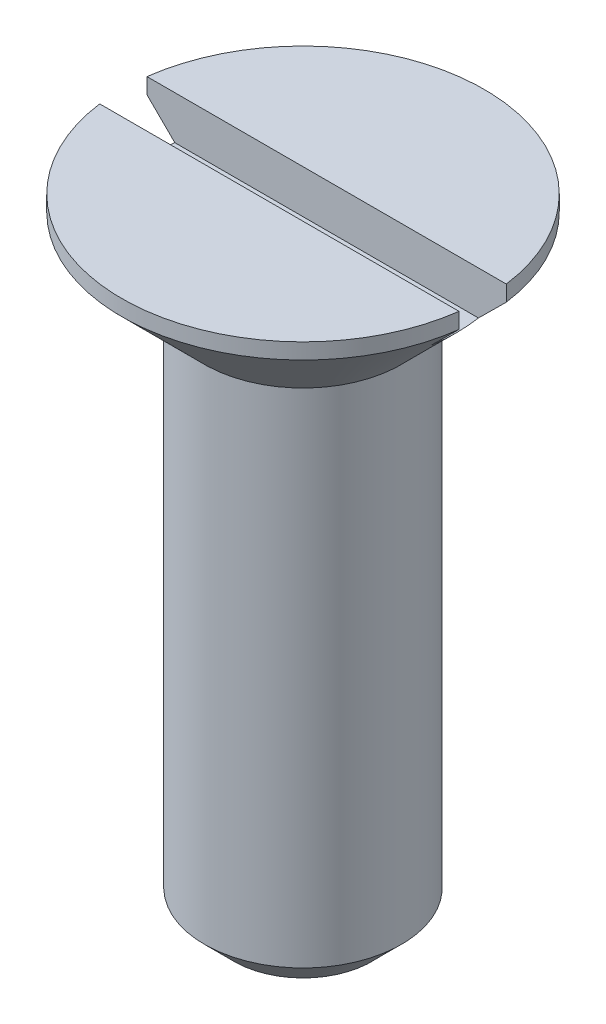
from build123d import *

# Parameters (mm, degrees)
SKETCH_13_W         = 9.2
SKETCH_13_H         = 1.2
CUT_EXTRUDE_9_DEPTH = 1.1
CHAMFER_1_SIZE      = 0.75


with BuildPart() as part:
    # Эскиз1 → Повернуть1 (revolve)
    with BuildSketch(Plane.XY):
        Polygon((0, 16), (0, 0), (2.5, 0), (2.5, 13.5), (4.6, 15.6), (4.6, 16), align=None)
    revolve(axis=Axis((0, 125.763182898, 0), (0, -1, 0)))

    # Эскиз13 → Вырез-Вытянуть9 (cut)
    with BuildSketch(Plane(origin=(0, 16, 0), x_dir=(-1, 0, 0), z_dir=(0, 1, 0))):
        Rectangle(SKETCH_13_W, SKETCH_13_H)
    extrude(amount=-CUT_EXTRUDE_9_DEPTH, mode=Mode.SUBTRACT)

    # Фаска1
    chamfer_1_edges = [part.edges().sort_by_distance(p)[0] for p in [
        (-2.5, 0, 0),
    ]]
    chamfer(chamfer_1_edges, length=CHAMFER_1_SIZE)


solid = part.part
